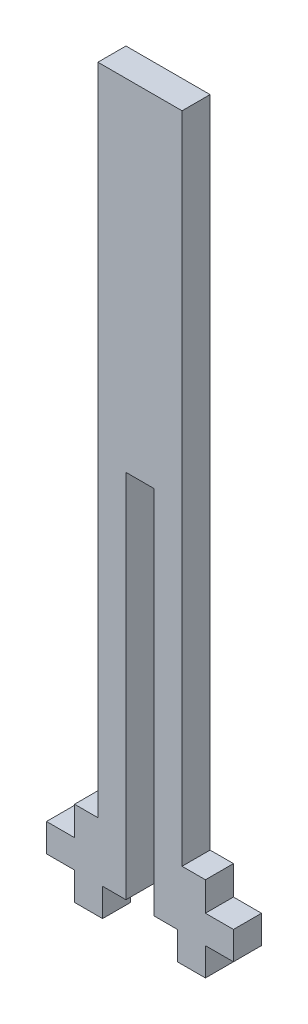
from build123d import *

# Parameters (mm, degrees)
EXTRUDE_1_DEPTH     = 3
SKETCH_2_W          = 3
SKETCH_2_H          = 36.493999941
CUT_EXTRUDE_1_DEPTH = 3
SKETCH_3_W          = 3
SKETCH_3_H          = 3
EXTRUDE_2_DEPTH     = 3
SKETCH_5_W          = 2.5
SKETCH_5_H          = 3.1
EXTRUDE_3_DEPTH     = 3


with BuildPart() as part:
    # 스케치1 → 보스-돌출1 (new body)
    with BuildSketch(Plane.XY):
        Polygon((-4.5, 39.543999941), (4.5, 39.543999941), (4.5, -30.443999941), (7, -30.443999941), (7, -39.543999941), (4, -39.543999941), (4, -33.443999941), (-4, -33.443999941), (-4, -39.543999941), (-7, -39.543999941), (-7, -30.443999941), (-4.5, -30.443999941), align=None)
    extrude(amount=EXTRUDE_1_DEPTH)

    # 스케치2 → 컷-돌출1 (cut)
    with BuildSketch(Plane(origin=(0, 0, 0), x_dir=(-1, 0, 0), z_dir=(0, 0, -1))):
        with Locations((0, -15.196999971)):
            Rectangle(SKETCH_2_W, SKETCH_2_H)
    extrude(amount=-CUT_EXTRUDE_1_DEPTH, mode=Mode.SUBTRACT)

    # 스케치3 → 보스-돌출2 (add)
    with BuildSketch(Plane.XY.offset(3)):
        with Locations((-8.5, -35.043999941)):
            Rectangle(SKETCH_3_W, SKETCH_3_H)
        with Locations((8.5, -35.043999941)):
            Rectangle(SKETCH_3_W, SKETCH_3_H)
    extrude(amount=-EXTRUDE_2_DEPTH)

    # 스케치5 → 보스-돌출3 (add)
    with BuildSketch(Plane.XY.offset(3)):
        with Locations((-2.75, -34.993999941)):
            Rectangle(SKETCH_5_W, SKETCH_5_H)
        with Locations((2.75, -34.993999941)):
            Rectangle(SKETCH_5_W, SKETCH_5_H)
    extrude(amount=-EXTRUDE_3_DEPTH)


solid = part.part
